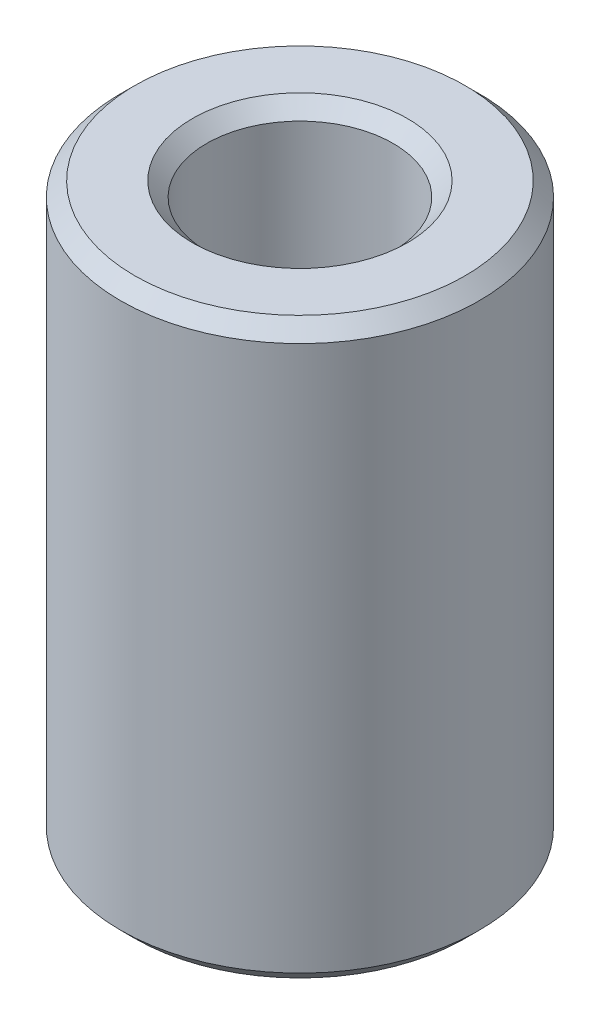
from build123d import *

# Parameters (mm, degrees)
SKIZZE1_R                       = 2.5
SKIZZE1_R_2                     = 1.3
AUFSATZ_LINEAR_AUSTRAGEN1_DEPTH = 8
FASE1_SIZE                      = 0.2


with BuildPart() as part:
    # Skizze1 → Aufsatz-Linear austragen1 (new body)
    with BuildSketch(Plane(origin=(0, 0, 0), x_dir=(1, 0, 0), z_dir=(0, 1, 0))):
        with Locations(Location((0, 0, 0), (0, 0, 270))):
            Circle(SKIZZE1_R)
        with Locations(Location((0, 0, 0), (0, 0, 270))):
            Circle(SKIZZE1_R_2, mode=Mode.SUBTRACT)
    extrude(amount=AUFSATZ_LINEAR_AUSTRAGEN1_DEPTH)

    # Fase1
    fase1_edges = [part.edges().sort_by_distance(p)[0] for p in [
        (0, 0, -2.5),
        (0, 8, -2.5),
        (0, 0, -1.3),
        (0, 8, -1.3),
    ]]
    chamfer(fase1_edges, length=FASE1_SIZE)


solid = part.part
